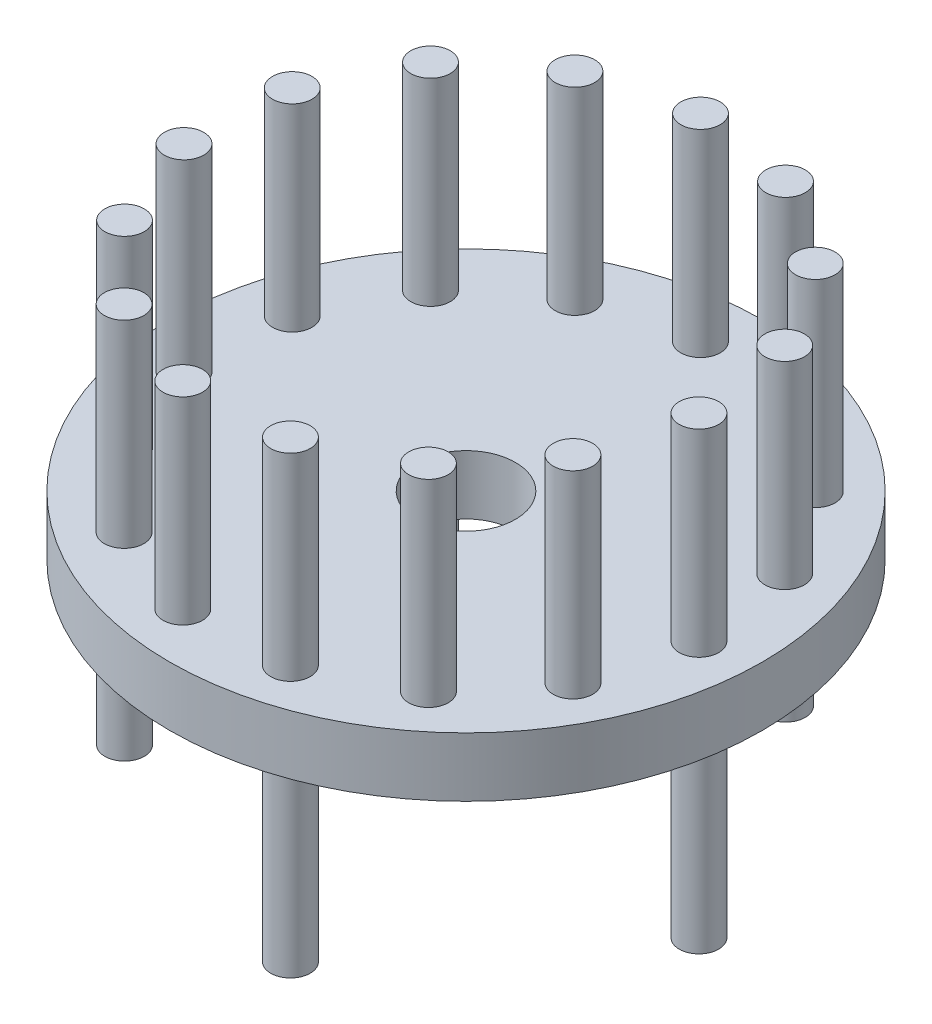
from build123d import *

# Parameters (mm, degrees)
SKETCH_1_R               = 15
SKETCH_1_R_2             = 2.5
EXTRUDE_1_DEPTH          = 3
SKETCH_2_R               = 1
EXTRUDE_2_DEPTH          = 10
PATTERN_CIRCULAR_1_COUNT = 15
EXTRUDE_START            = 10
SKETCH_3_R               = 1
EXTRUDE_3_DEPTH          = 10
PATTERN_CIRCULAR_2_COUNT = 5


with BuildPart() as part:
    # 草圖1 → 填料-伸長1 (new body)
    with BuildSketch(Plane(origin=(0, 0, 0), x_dir=(1, 0, 0), z_dir=(0, 1, 0))):
        with Locations(Location((0, 0, 0), (0, 0, 270))):
            Circle(SKETCH_1_R)
        with Locations(Location((0, 0, 0), (0, 0, 270))):
            Circle(SKETCH_1_R_2, mode=Mode.SUBTRACT)
    extrude(amount=EXTRUDE_1_DEPTH)

    # 草圖2 → 填料-伸長2 (add)
    with BuildSketch(Plane(origin=(0, 3, 0), x_dir=(1, 0, 0), z_dir=(0, 1, 0))):
        with Locations(Location((12.4808724, -0.691248248, 0), (0, 0, 270))):
            Circle(SKETCH_2_R)
    extrude_2 = extrude(amount=EXTRUDE_2_DEPTH)

    # 環狀複製排列1: 填料-伸長2 ×15 about axis
    pattern_circular_1_axis = Axis((0, 0, 0), (0, 1, 0))
    for i in range(1, PATTERN_CIRCULAR_1_COUNT):
        add(extrude_2.rotate(pattern_circular_1_axis, i * 360 / PATTERN_CIRCULAR_1_COUNT))

    # 草圖3 → 填料-伸長3 (add)
    with BuildSketch(Plane.XZ.offset(EXTRUDE_START)):
        with Locations(Location((12.4808724, 0.691248248, 0), (0, 0, 90))):
            Circle(SKETCH_3_R)
    extrude_3 = extrude(amount=-EXTRUDE_3_DEPTH)

    # 環狀複製排列2: 填料-伸長3 ×5 about axis
    pattern_circular_2_axis = Axis((0, 0, 0), (0, 1, 0))
    for i in range(1, PATTERN_CIRCULAR_2_COUNT):
        add(extrude_3.rotate(pattern_circular_2_axis, i * 360 / PATTERN_CIRCULAR_2_COUNT))


solid = part.part
